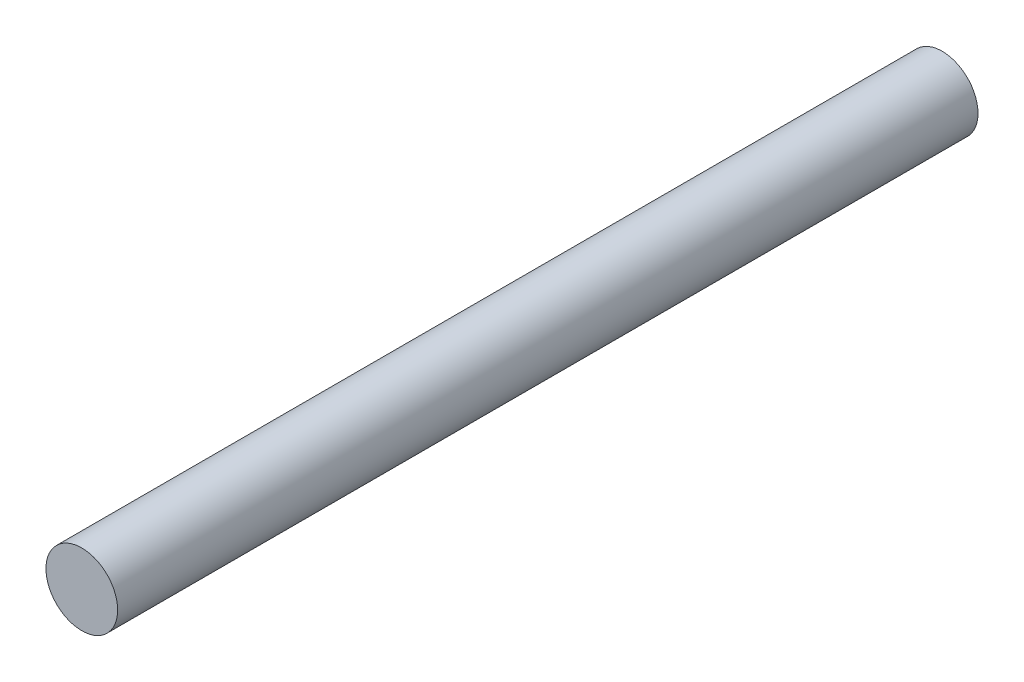
from build123d import *

# Parameters (mm, degrees)
ESBO_O1_R                = 5
RESSALTO_EXTRUS_O1_DEPTH = 60


with BuildPart() as part:
    # Esboço1 → Ressalto-extrusão1 (new, symmetric)
    with BuildSketch(Plane.XY):
        Circle(ESBO_O1_R)
    extrude(amount=RESSALTO_EXTRUS_O1_DEPTH, both=True)


solid = part.part
